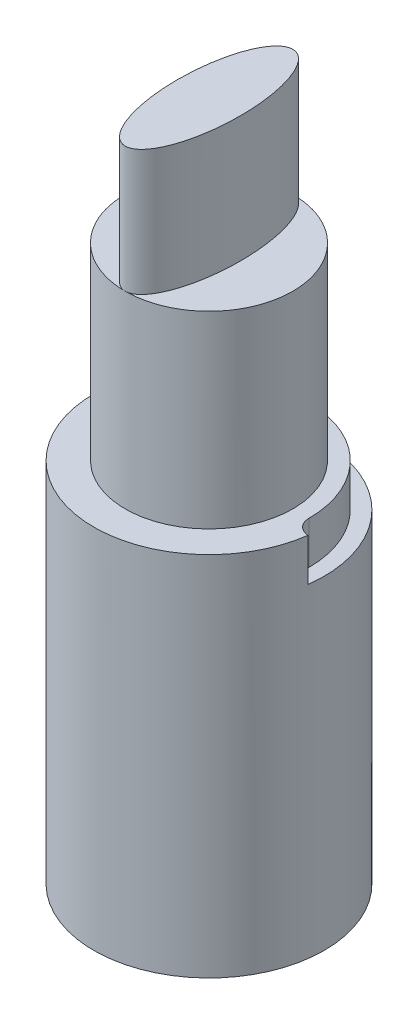
from build123d import *

# Parameters (mm, degrees)
SKETCH1_RX              = 8
SKETCH1_RY              = 3
BOSS_EXTRUDE1_DEPTH     = 12
SKETCH3_R               = 8
BOSS_EXTRUDE2_DEPTH     = 18
SKETCH13_R              = 11
BOSS_EXTRUDE3_DEPTH     = 35
CUT_EXTRUDE5_START      = -29
SKETCH18_R              = 8
CUT_EXTRUDE5_DEPTH      = 29
CUT_EXTRUDE6_START      = -4
CUT_EXTRUDE6_DEPTH      = 4
CUT_EXTRUDE7_DEPTH      = 4.064
CUT_EXTRUDE8_REACH      = 951.71
CUT_EXTRUDE8_END_RADIUS = 8
SKETCH21_R              = 1.4605
LPATTERN1_COUNT         = 7
LPATTERN1_PITCH         = 3.5


with BuildPart() as part:
    # Sketch1 → Boss-Extrude1 (new body)
    with BuildSketch(Plane(origin=(-15.034281637, 949.098073669, 12.409539786), x_dir=(0, 0, 1), z_dir=(0, 1, 0))):
        with Locations(Location((20, 0), (0, 0, 180))):
            Ellipse(SKETCH1_RX, SKETCH1_RY)
    extrude(amount=-BOSS_EXTRUDE1_DEPTH)

    # Sketch3 → Boss-Extrude2 (add)
    with BuildSketch(Plane.XZ.offset(-937.098073669)):
        with Locations(Location((-15.034281637, 32.409539786, 0), (0, 0, 270))):
            Circle(SKETCH3_R)
    extrude(amount=BOSS_EXTRUDE2_DEPTH)

    # Sketch13 → Boss-Extrude3 (add)
    with BuildSketch(Plane.XZ.offset(-919.098073669)):
        with Locations((-15.034281637, 32.409539786)):
            Circle(SKETCH13_R)
    extrude(amount=BOSS_EXTRUDE3_DEPTH)

    # Sketch18 → Cut-Extrude5 (cut)
    with BuildSketch(Plane.XZ.offset(-884.098073669).offset(CUT_EXTRUDE5_START)):
        with Locations(Location((-15.034281637, 32.409539786, 0), (0, 0, 270))):
            Circle(SKETCH18_R)
    extrude(amount=CUT_EXTRUDE5_DEPTH, mode=Mode.SUBTRACT)

    # Sketch19 → Cut-Extrude6 (cut)
    with BuildSketch(Plane.XZ.offset(-913.098073669).offset(CUT_EXTRUDE6_START)):
        with BuildLine():
            Line((-16.034281637, 31.291505797), (-16.034281637, 25.409539786))
            ThreePointArc((-16.034281637, 25.409539786), (-15.741388419, 24.702433005), (-15.034281637, 24.409539786))
            ThreePointArc((-15.034281637, 24.409539786), (-9.377427388, 26.752685537), (-7.034281637, 32.409539786))
            ThreePointArc((-7.034281637, 32.409539786), (-7.327174856, 33.116646567), (-8.034281637, 33.409539786))
            Line((-8.034281637, 33.409539786), (-13.916247649, 33.409539786))
            ThreePointArc((-13.916247649, 33.409539786), (-16.094941809, 33.470199958), (-16.034281637, 31.291505797))
        make_face()
    extrude(amount=CUT_EXTRUDE6_DEPTH, mode=Mode.SUBTRACT)

    # Sketch20 → Cut-Extrude7 (cut)
    with BuildSketch(Plane(origin=(0, 919.098073669, 0), x_dir=(1, 0, 0), z_dir=(0, 1, 0))):
        with BuildLine():
            ThreePointArc((-5.494781637, -32.409539786), (-4.034281637, -33.870039786), (-2.573781637, -32.409539786))
            ThreePointArc((-2.573781637, -32.409539786), (-6.223377591, -23.598635739), (-15.034281637, -19.949039786))
            ThreePointArc((-15.034281637, -19.949039786), (-16.494781637, -21.409539786), (-15.034281637, -22.870039786))
            ThreePointArc((-15.034281637, -22.870039786), (-8.288836498, -25.664094647), (-5.494781637, -32.409539786))
        make_face()
    extrude(amount=-CUT_EXTRUDE7_DEPTH, mode=Mode.SUBTRACT)

    # Cut-Extrude8: up to this cylinder (the profile starts outside it)
    cut_extrude8_end = Plane(origin=(-15.034281637, 886.598074, 32.409539786), z_dir=(0, -1, 0)) * Cylinder(CUT_EXTRUDE8_END_RADIUS, 1920.42, mode=Mode.PRIVATE)
    # Sketch21 → Cut-Extrude8 (cut, up to the surface)
    with BuildSketch(Plane.XY.offset(21.409539786), mode=Mode.PRIVATE) as cut_extrude8_sk1:
        with Locations(Location((-15.034281637, 886.598073669, 0), (0, 0, 180))):
            Circle(SKETCH21_R)
    cut_extrude8_tool1 = extrude(cut_extrude8_sk1.sketch, amount=CUT_EXTRUDE8_REACH, mode=Mode.PRIVATE) - cut_extrude8_end
    cut_extrude8 = cut_extrude8_tool1.solids().sort_by_distance((-15.034282, 886.598074, 21.40954))[0]
    add(cut_extrude8, mode=Mode.SUBTRACT)

    # LPattern1: Cut-Extrude8 ×7
    with Locations(*[(0, i * LPATTERN1_PITCH, 0) for i in range(1, LPATTERN1_COUNT)]):
        add(cut_extrude8, mode=Mode.SUBTRACT)


solid = part.part
